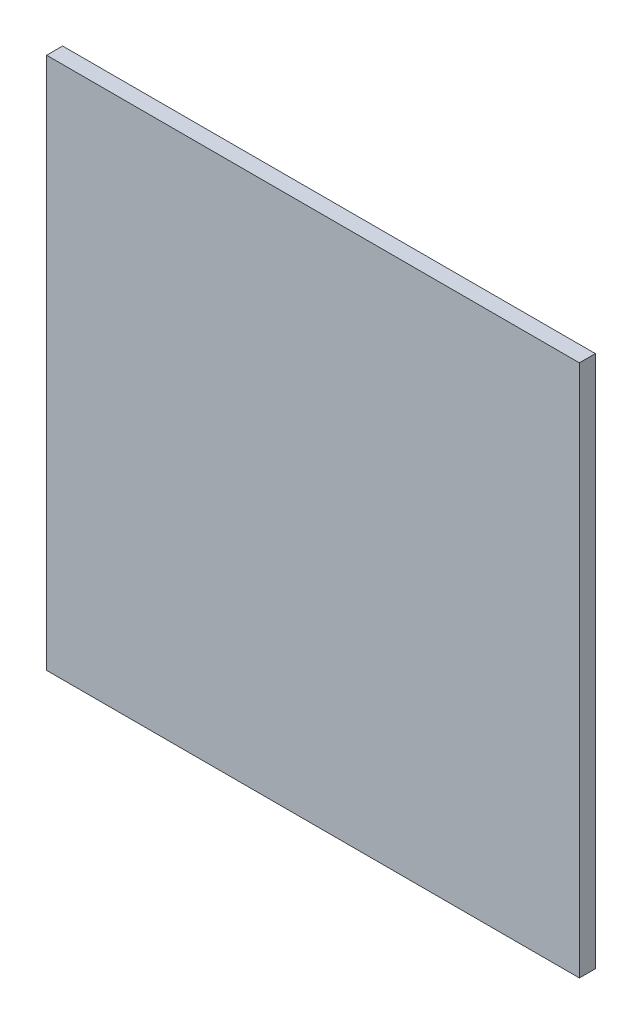
from build123d import *

# Parameters (mm, degrees)
SKETCH2_W           = 100
SKETCH2_H           = 100
BOSS_EXTRUDE1_DEPTH = 3


with BuildPart() as part:
    # Sketch2 → Boss-Extrude1 (new body)
    with BuildSketch(Plane.XY):
        Rectangle(SKETCH2_W, SKETCH2_H)
    extrude(amount=BOSS_EXTRUDE1_DEPTH)


solid = part.part
